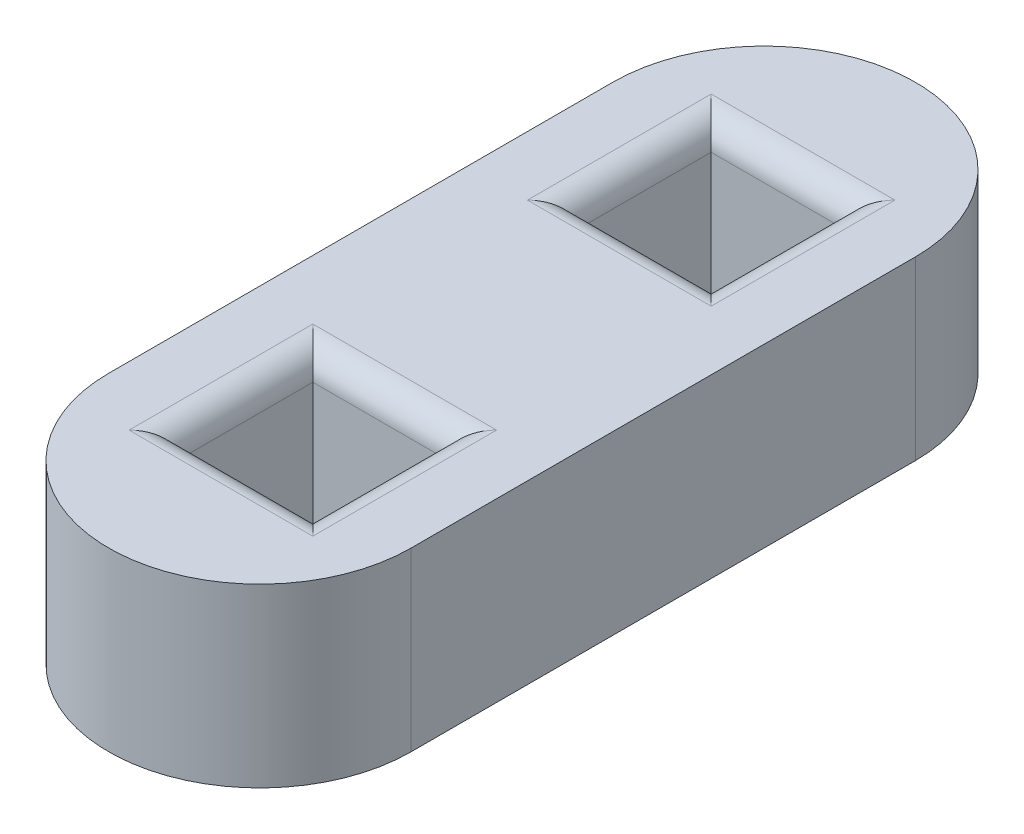
from build123d import *

# Parameters (mm, degrees)
SKETCH4_W           = 5.288
SKETCH4_H           = 5.288
BOSS_EXTRUDE1_DEPTH = 7
FILLET1_R           = 1


with BuildPart() as part:
    # Sketch4 → Boss-Extrude1 (new body)
    with BuildSketch(Plane(origin=(0, 0, 0), x_dir=(1, 0, 0), z_dir=(0, 1, 0))):
        with BuildLine():
            Line((6, 0), (6, -20))
            ThreePointArc((6, -20), (0, -26), (-6, -20))
            Line((-6, -20), (-6, 0))
            ThreePointArc((-6, 0), (0, 6), (6, 0))
        make_face()
        with Locations((0, -17.9)):
            Rectangle(SKETCH4_W, SKETCH4_H, mode=Mode.SUBTRACT)
        with Locations((0, -2.1)):
            Rectangle(SKETCH4_W, SKETCH4_H, mode=Mode.SUBTRACT)
    extrude(amount=BOSS_EXTRUDE1_DEPTH)

    # Fillet1
    fillet1_edges = [part.edges().sort_by_distance(p)[0] for p in [
        (2.644, 0, 2.1),
        (0, 0, -0.544),
        (-2.644, 0, 2.1),
        (0, 0, 4.744),
        (2.644, 7, 2.1),
        (0, 7, -0.544),
        (-2.644, 7, 2.1),
        (0, 7, 4.744),
        (-2.644, 0, 17.9),
        (0, 0, 20.544),
        (2.644, 0, 17.9),
        (0, 0, 15.256),
        (-2.644, 7, 17.9),
        (0, 7, 20.544),
        (2.644, 7, 17.9),
        (0, 7, 15.256),
    ]]
    fillet(fillet1_edges, radius=FILLET1_R)


solid = part.part
